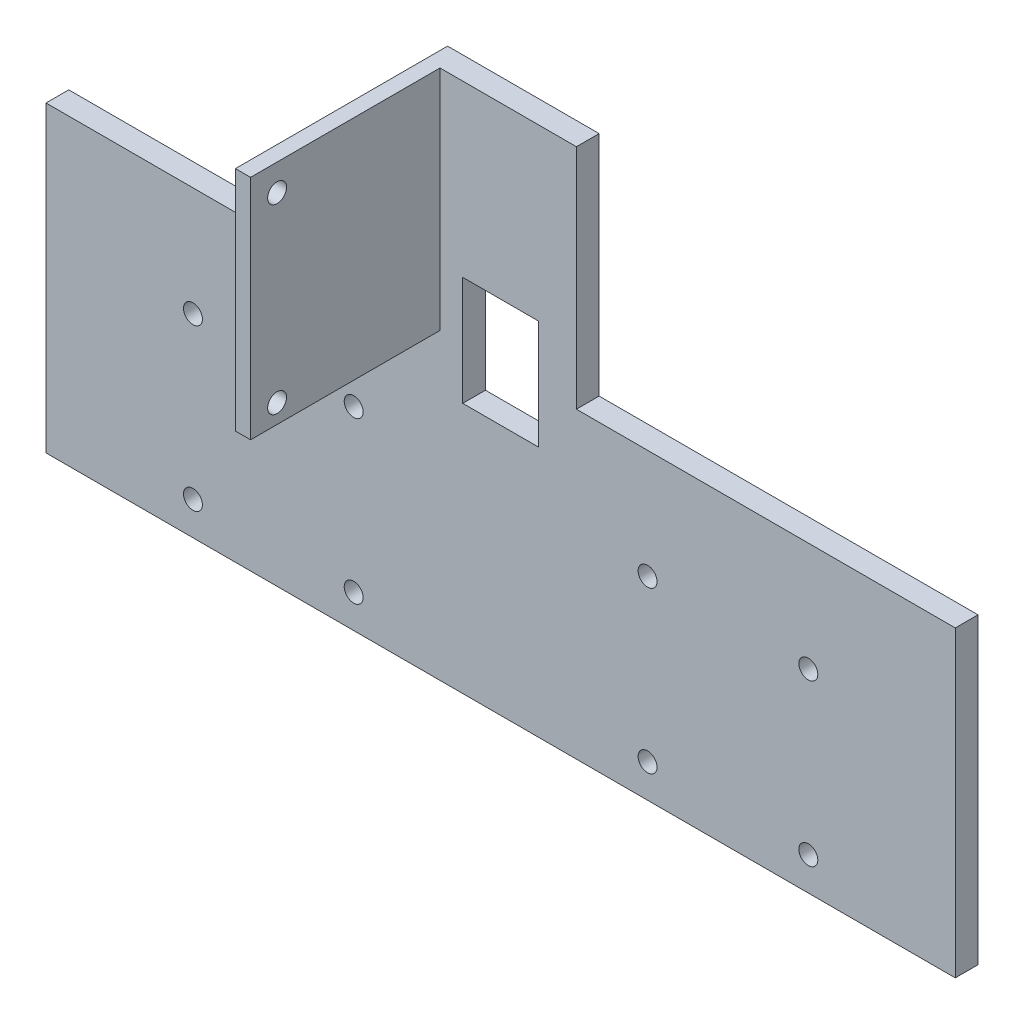
from build123d import *

# Parameters (mm, degrees)
EXTRUDE_1_DEPTH     = 3
SKETCH_2_W          = 2
SKETCH_2_H          = 30
EXTRUDE_2_DEPTH     = 25
CUT_EXTRUDE_1_REACH = 84.006
SKETCH_5_W          = 10
SKETCH_5_H          = 14.402378288
HOLE_WIZARD_M3_2_D  = 2.5
HOLE_WIZARD_M3_3_D  = 2.5


with BuildPart() as part:
    # 草图1 → 凸台-拉伸1 (new body)
    with BuildSketch(Plane.XY):
        Polygon((-60, 20), (-60, -20), (60, -20), (60, 20), (10, 20), (10, 50), (-10, 50), (-10, 20), align=None)
    extrude(amount=EXTRUDE_1_DEPTH)

    # 草图2 → 凸台-拉伸2 (add)
    with BuildSketch(Plane.XY.offset(3)):
        with Locations((-9, 35)):
            Rectangle(SKETCH_2_W, SKETCH_2_H)
    extrude(amount=EXTRUDE_2_DEPTH)

    # 草图5 → 切除-拉伸1 (cut, up to next)
    with BuildSketch(Plane.XY.offset(3), mode=Mode.PRIVATE) as cut_extrude_1_sk1:
        with Locations((0, 20.369307695)):
            Rectangle(SKETCH_5_W, SKETCH_5_H)
    cut_extrude_1_tool1 = extrude(cut_extrude_1_sk1.sketch, amount=-CUT_EXTRUDE_1_REACH, mode=Mode.PRIVATE) & part.part
    add(cut_extrude_1_tool1.solids().sort_by_distance((0, 20.369308, 3))[0], mode=Mode.SUBTRACT)

    # M3 螺纹孔2 (through all)
    with Locations(Plane.ZY.offset(10)):
        with Locations((24.5, 46.5), (24.5, 22.5)):
            Hole(HOLE_WIZARD_M3_2_D / 2)

    # M3 螺纹孔3 (through all)
    with Locations(Plane.XY.offset(3)):
        with Locations((-40.606601718, 5.606601718), (-19.393398282, 5.606601718), (-19.393398282, -15.606601718), (-40.606601718, -15.606601718), (19.393398282, 5.606601718), (40.606601718, 5.606601718), (19.393398282, -15.606601718), (40.606601718, -15.606601718)):
            Hole(HOLE_WIZARD_M3_3_D / 2)


solid = part.part
